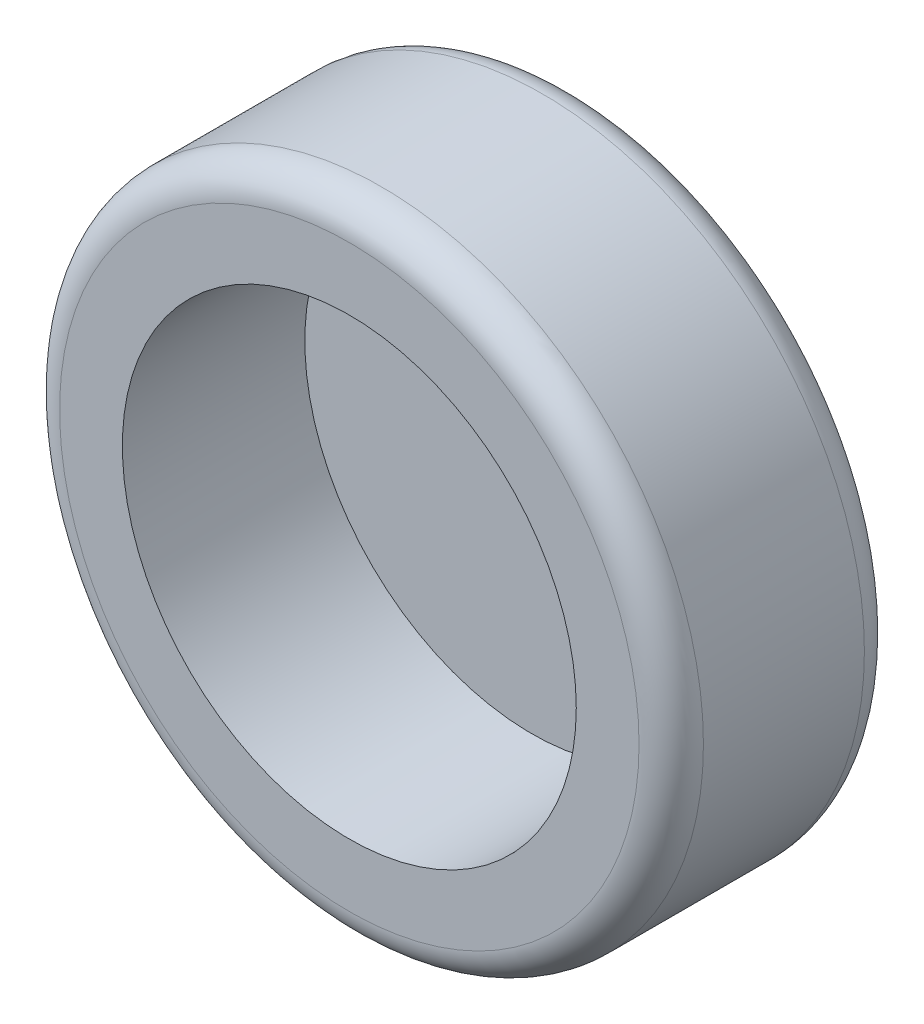
from build123d import *

# Parameters (mm, degrees)
SKETCH_1_R          = 30
EXTRUDE_1_DEPTH     = 21
SKETCH_2_R          = 21.15
CUT_EXTRUDE_1_DEPTH = 17


with BuildPart() as part:
    # 草图1 → 凸台-拉伸1 (new body)
    with BuildSketch(Plane.XY):
        with Locations(Location((0, 0, 0), (0, 0, 180))):
            Circle(SKETCH_1_R)
    extrude(amount=EXTRUDE_1_DEPTH)

    # 草图2 → 切除-拉伸1 (cut)
    with BuildSketch(Plane.XY.offset(21)):
        Circle(SKETCH_2_R)
    extrude(amount=-CUT_EXTRUDE_1_DEPTH, mode=Mode.SUBTRACT)

    # 草图4 → 切除-旋转1 (revolve, cut)
    with BuildSketch(Plane(origin=(0, 0, 0), x_dir=(1, 0, 0), z_dir=(0, 1, 0)), mode=Mode.PRIVATE) as cut_revolve_1_sk:
        with BuildLine():
            ThreePointArc((-27, 0), (-29.121320344, -0.878679656), (-30, -3))
            Line((-30, -3), (-30, 0))
            Line((-30, 0), (-27, 0))
        make_face()
        with BuildLine():
            ThreePointArc((-30, -18), (-29.121320344, -20.121320344), (-27, -21))
            Line((-27, -21), (-30, -21))
            Line((-30, -21), (-30, -18))
        make_face()
    revolve(cut_revolve_1_sk.sketch.rotate(Axis((0, 0, 0), (0, 0, -1)), 180), axis=Axis((0, 0, 0), (0, 0, -1)), mode=Mode.SUBTRACT)


solid = part.part
